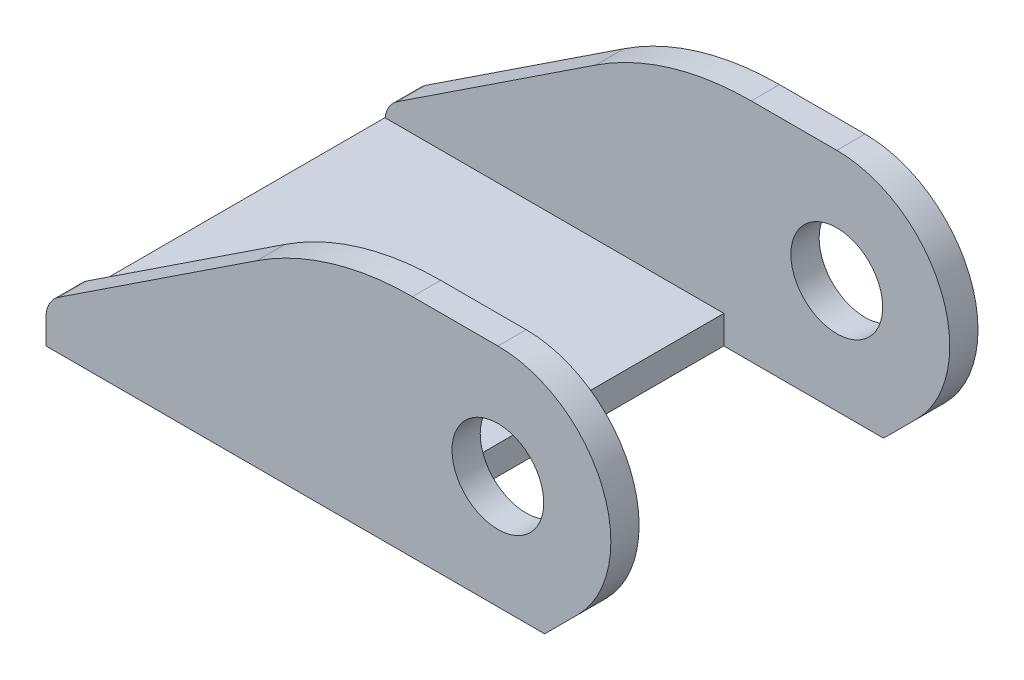
from build123d import *

# Parameters (mm, degrees)
SKETCH6_W               = 40
SKETCH6_H               = 2
BOSS_EXTRUDE4_DEPTH     = 16
SKETCH9_R               = 3.25
CUT_EXTRUDE2_DEPTH      = 2
CUT_EXTRUDE1_DEPTH      = 26.690465157
CUT_EXTRUDE1_DEPTH_BACK = 16
SKETCH7_W               = 42.708590122
SKETCH7_H               = 18.182038554
SKETCH12_W              = 23.999933515
SKETCH12_H              = 26
SKETCH12_R              = 1.75
BOSS_EXTRUDE8_DEPTH     = 2


with BuildPart() as part:
    # Sketch6 → Boss-Extrude4 (new body)
    with BuildSketch(Plane(origin=(0, 0, 0), x_dir=(1, 0, 0), z_dir=(0, 1, 0))):
        with Locations((0, -12)):
            Rectangle(SKETCH6_W, SKETCH6_H)
    extrude(amount=BOSS_EXTRUDE4_DEPTH)

    # Sketch9 → Cut-Extrude2 (cut)
    with BuildSketch(Plane(origin=(0, 0, 11), x_dir=(-1, 0, 0), z_dir=(0, 0, -1))):
        with Locations((-12, 8)):
            Circle(SKETCH9_R)
    extrude(amount=-CUT_EXTRUDE2_DEPTH, mode=Mode.SUBTRACT)

    # Sketch7 → Cut-Extrude1 (cut, two sides: drawn at the far end of the back side and taken through both)
    with BuildSketch(Plane(origin=(0, 0, 11), x_dir=(-1, 0, 0), z_dir=(0, 0, -1)).offset(-CUT_EXTRUDE1_DEPTH_BACK)):
        with Locations((0, 8)):
            Rectangle(SKETCH7_W, SKETCH7_H)
        with BuildLine():
            Line((-5.942038411, 16), (-12, 16))
            ThreePointArc((-12, 16), (-19.39103626, 11.061467459), (-17.656854249, 2.343145751))
            Line((-17.656854249, 2.343145751), (-15.313708499, 0))
            Line((-15.313708499, 0), (20, 0))
            Line((20, 0), (20, 1.767244224))
            ThreePointArc((20, 1.767244224), (19.761112544, 2.715127447), (19.101517394, 3.43657326))
            Line((19.101517394, 3.43657326), (5.07313553, 12.69329036))
            ThreePointArc((5.07313553, 12.69329036), (-0.191638738, 15.155492779), (-5.942038411, 16))
        make_face(mode=Mode.SUBTRACT)
    extrude(amount=CUT_EXTRUDE1_DEPTH + CUT_EXTRUDE1_DEPTH_BACK, mode=Mode.SUBTRACT)


with BuildPart() as body_2:
    # Mirror2: mirrored copy
    add(part.part.mirror(Plane.XY))


with BuildPart() as part_1:
    add(part.part)

    add(body_2.part)  # Boss-Extrude8 merges body 2
    # Sketch12 → Boss-Extrude8 (add)
    with BuildSketch(Plane(origin=(0, 0, 0), x_dir=(1, 0, 0), z_dir=(0, 1, 0))):
        with Locations((-8.000033242, 0)):
            Rectangle(SKETCH12_W, SKETCH12_H)
        with Locations(Location((-13.000047854, 0, 0), (0, 0, 270))):
            Circle(SKETCH12_R, mode=Mode.SUBTRACT)
        with Locations(Location((-3.000047854, 0, 0), (0, 0, 270))):
            Circle(SKETCH12_R, mode=Mode.SUBTRACT)
    extrude(amount=BOSS_EXTRUDE8_DEPTH)


solid = part_1.part
